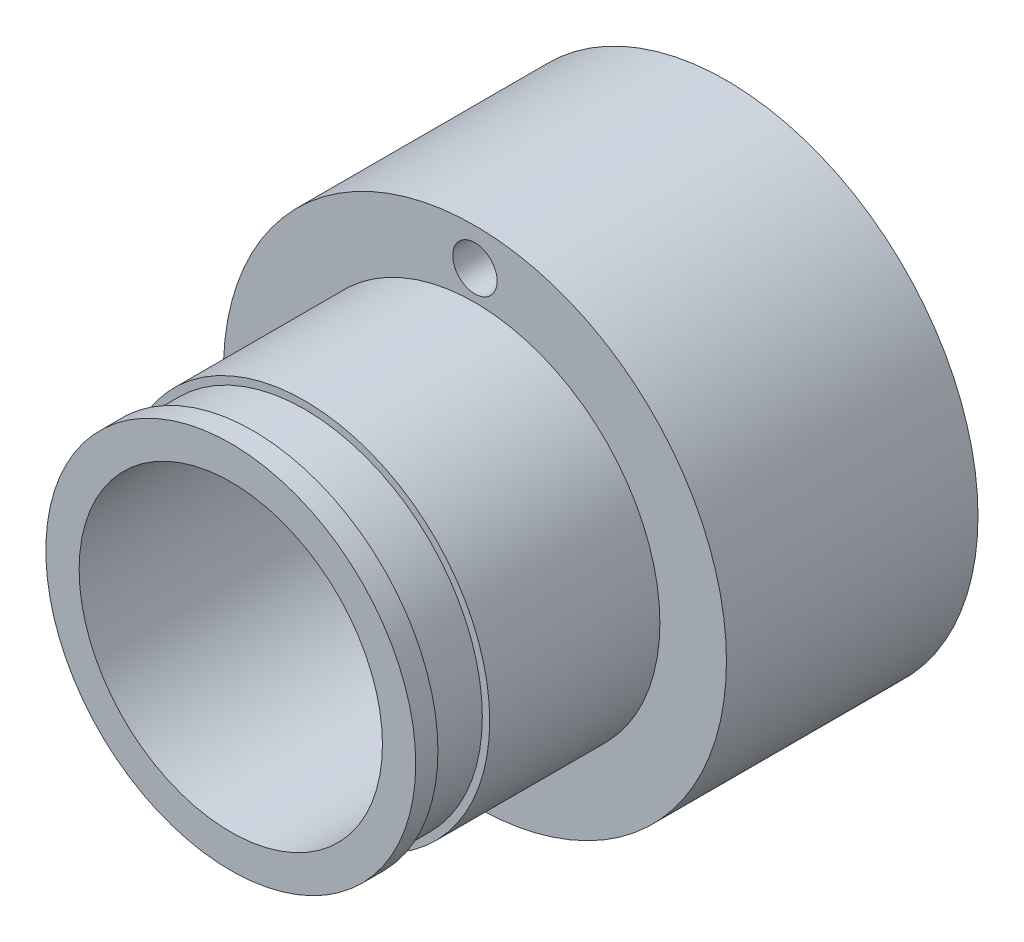
from build123d import *

# Parameters (mm, degrees)
ESQUISSE1_R                       = 17
BOSS_EXTRU_1_DEPTH                = 17
ESQUISSE2_R                       = 12.5
BOSS_EXTRU_2_DEPTH                = 11.5
ESQUISSE3_R                       = 12
BOSS_EXTRU_3_DEPTH                = 3.5
ESQUISSE4_R                       = 12.5
BOSS_EXTRU_4_DEPTH                = 1.5
ESQUISSE5_R                       = 10.25
ENL_V_MAT_EXTRU_1_DEPTH           = 30
ESQUISSE6_R                       = 10.25
ESQUISSE6_R_2                     = 6.75
ENL_V_MAT_EXTRU_2_DEPTH           = 1.5
ESQUISSE7_R                       = 12
ESQUISSE7_R_2                     = 10.25
ENL_V_MAT_EXTRU_3_DEPTH           = 2
DIAM_TRE_DU_PER_AGE_3_0_3_1_D     = 3
DIAM_TRE_DU_PER_AGE_3_0_3_1_DEPTH = 12
DIAM_TRE_DU_PER_AGE_3_0_3_1_TIP   = 0.901290929


with BuildPart() as part:
    # Esquisse1 → Boss.-Extru.1 (new body)
    with BuildSketch(Plane.XY):
        Circle(ESQUISSE1_R)
    extrude(amount=BOSS_EXTRU_1_DEPTH)

    # Esquisse2 → Boss.-Extru.2 (add)
    with BuildSketch(Plane.XY.offset(17)):
        Circle(ESQUISSE2_R)
    extrude(amount=BOSS_EXTRU_2_DEPTH)

    # Esquisse3 → Boss.-Extru.3 (add)
    with BuildSketch(Plane.XY.offset(28.5)):
        Circle(ESQUISSE3_R)
    extrude(amount=BOSS_EXTRU_3_DEPTH)

    # Esquisse4 → Boss.-Extru.4 (add)
    with BuildSketch(Plane.XY.offset(32)):
        Circle(ESQUISSE4_R)
    extrude(amount=BOSS_EXTRU_4_DEPTH)

    # Esquisse5 → Enlèv. mat.-Extru.1 (cut)
    with BuildSketch(Plane.XY.offset(33.5)):
        Circle(ESQUISSE5_R)
    extrude(amount=-ENL_V_MAT_EXTRU_1_DEPTH, mode=Mode.SUBTRACT)

    # Esquisse6 → Enlèv. mat.-Extru.2 (cut)
    with BuildSketch(Plane.XY.offset(3.5)):
        Circle(ESQUISSE6_R)
        Circle(ESQUISSE6_R_2, mode=Mode.SUBTRACT)
    extrude(amount=-ENL_V_MAT_EXTRU_2_DEPTH, mode=Mode.SUBTRACT)

    # Esquisse7 → Enlèv. mat.-Extru.3 (cut)
    with BuildSketch(Plane.XY.offset(3.5)):
        Circle(ESQUISSE7_R)
        Circle(ESQUISSE7_R_2, mode=Mode.SUBTRACT)
    extrude(amount=ENL_V_MAT_EXTRU_3_DEPTH, mode=Mode.SUBTRACT)

    # Diamètre du perçage Ø3.0 (3)1
    with Locations(Plane.XY.offset(17)):
        with Locations((0, 14.5)):
            Hole(DIAM_TRE_DU_PER_AGE_3_0_3_1_D / 2, depth=DIAM_TRE_DU_PER_AGE_3_0_3_1_DEPTH)
            with Locations((0, 0, -(DIAM_TRE_DU_PER_AGE_3_0_3_1_DEPTH + DIAM_TRE_DU_PER_AGE_3_0_3_1_TIP / 2))):  # 118° drill point
                Cone(0, DIAM_TRE_DU_PER_AGE_3_0_3_1_D / 2, DIAM_TRE_DU_PER_AGE_3_0_3_1_TIP, mode=Mode.SUBTRACT)


solid = part.part
